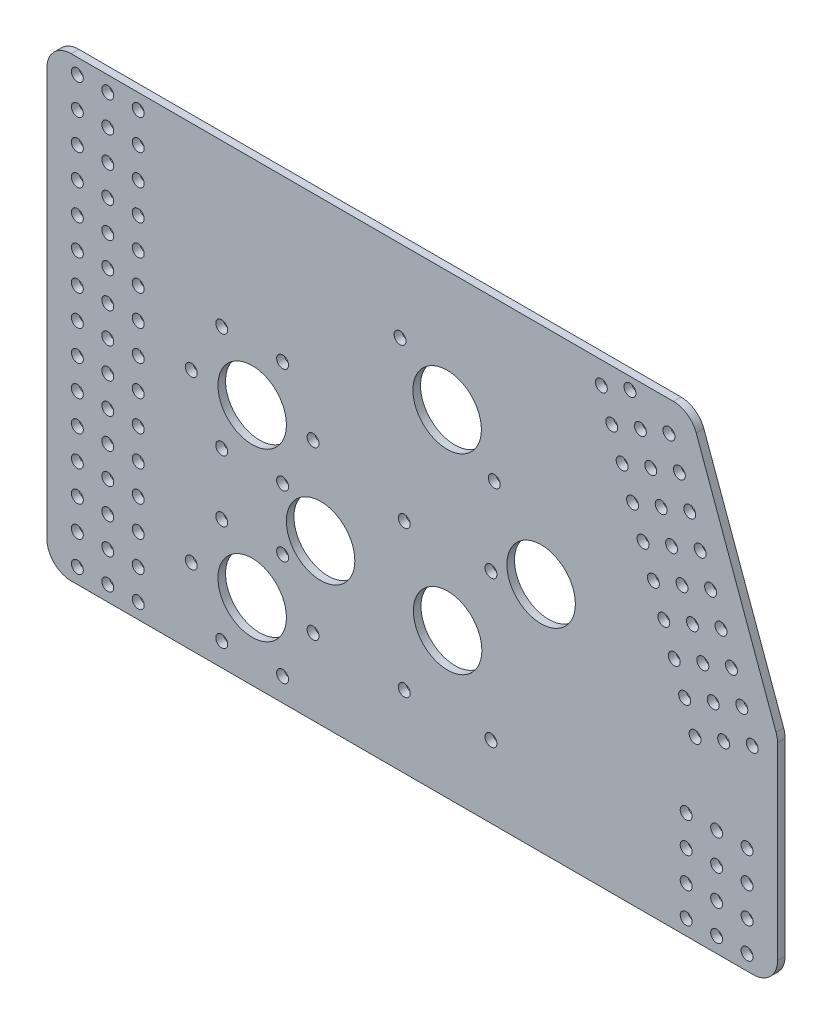
from build123d import *

# Parameters (mm, degrees)
SKETCH6_R           = 2.4892
SKETCH6_R_2         = 14.2875
BOSS_EXTRUDE1_DEPTH = 3.175
FILLET1_R           = 10.16
CUT_EXTRUDE1_START  = -3.175
SKETCH7_R           = 14.2875
SKETCH7_R_2         = 2.4892
CUT_EXTRUDE1_DEPTH  = 3.175
BOSS_EXTRUDE3_START = -3.175
SKETCH8_R           = 2.4892
BOSS_EXTRUDE3_DEPTH = 3.175
BOSS_EXTRUDE4_START = -3.175
SKETCH10_R          = 2.4892
BOSS_EXTRUDE4_DEPTH = 3.175


with BuildPart() as part:
    # Sketch6 → Boss-Extrude1 (new body)
    with BuildSketch(Plane.XY):
        Polygon((-62.034734806, 275.060295422), (206.435304788, 275.060295422), (242.765265194, 175.244549557), (242.765265194, 84.560295422), (-62.034734806, 84.560295422), align=None)
        with Locations((123.22406409, 114.608841068)):
            Circle(SKETCH6_R, mode=Mode.SUBTRACT)
        with Locations(Location((87.05446409, 114.608841068, 0), (0, 0, 180))):
            Circle(SKETCH6_R, mode=Mode.SUBTRACT)
        with Locations((-49.334734806, 268.710295422)):
            Circle(SKETCH6_R, mode=Mode.SUBTRACT)
        with Locations((-49.334734806, 90.910295422)):
            Circle(SKETCH6_R, mode=Mode.SUBTRACT)
        with Locations((-36.634734806, 268.710295422)):
            Circle(SKETCH6_R, mode=Mode.SUBTRACT)
        with Locations((-23.934734806, 268.710295422)):
            Circle(SKETCH6_R, mode=Mode.SUBTRACT)
        with Locations((-36.634734806, 256.010295422)):
            Circle(SKETCH6_R, mode=Mode.SUBTRACT)
        with Locations((-23.934734806, 256.010295422)):
            Circle(SKETCH6_R, mode=Mode.SUBTRACT)
        with Locations((-36.634734806, 243.310295422)):
            Circle(SKETCH6_R, mode=Mode.SUBTRACT)
        with Locations((-23.934734806, 243.310295422)):
            Circle(SKETCH6_R, mode=Mode.SUBTRACT)
        with Locations((-36.634734806, 230.610295422)):
            Circle(SKETCH6_R, mode=Mode.SUBTRACT)
        with Locations((-23.934734806, 230.610295422)):
            Circle(SKETCH6_R, mode=Mode.SUBTRACT)
        with Locations((-36.634734806, 217.910295422)):
            Circle(SKETCH6_R, mode=Mode.SUBTRACT)
        with Locations((-23.934734806, 217.910295422)):
            Circle(SKETCH6_R, mode=Mode.SUBTRACT)
        with Locations((-36.634734806, 205.210295422)):
            Circle(SKETCH6_R, mode=Mode.SUBTRACT)
        with Locations((-23.934734806, 205.210295422)):
            Circle(SKETCH6_R, mode=Mode.SUBTRACT)
        with Locations((-36.634734806, 192.510295422)):
            Circle(SKETCH6_R, mode=Mode.SUBTRACT)
        with Locations((-23.934734806, 192.510295422)):
            Circle(SKETCH6_R, mode=Mode.SUBTRACT)
        with Locations((-36.634734806, 179.810295422)):
            Circle(SKETCH6_R, mode=Mode.SUBTRACT)
        with Locations((-23.934734806, 179.810295422)):
            Circle(SKETCH6_R, mode=Mode.SUBTRACT)
        with Locations((-36.634734806, 167.110295422)):
            Circle(SKETCH6_R, mode=Mode.SUBTRACT)
        with Locations((-23.934734806, 167.110295422)):
            Circle(SKETCH6_R, mode=Mode.SUBTRACT)
        with Locations((-36.634734806, 154.410295422)):
            Circle(SKETCH6_R, mode=Mode.SUBTRACT)
        with Locations((-23.934734806, 154.410295422)):
            Circle(SKETCH6_R, mode=Mode.SUBTRACT)
        with Locations((-36.634734806, 141.710295422)):
            Circle(SKETCH6_R, mode=Mode.SUBTRACT)
        with Locations((-23.934734806, 141.710295422)):
            Circle(SKETCH6_R, mode=Mode.SUBTRACT)
        with Locations((-36.634734806, 129.010295422)):
            Circle(SKETCH6_R, mode=Mode.SUBTRACT)
        with Locations((-23.934734806, 129.010295422)):
            Circle(SKETCH6_R, mode=Mode.SUBTRACT)
        with Locations((-36.634734806, 116.310295422)):
            Circle(SKETCH6_R, mode=Mode.SUBTRACT)
        with Locations((-23.934734806, 116.310295422)):
            Circle(SKETCH6_R, mode=Mode.SUBTRACT)
        with Locations((-36.634734806, 103.610295422)):
            Circle(SKETCH6_R, mode=Mode.SUBTRACT)
        with Locations((-23.934734806, 103.610295422)):
            Circle(SKETCH6_R, mode=Mode.SUBTRACT)
        with Locations((-36.634734806, 90.910295422)):
            Circle(SKETCH6_R, mode=Mode.SUBTRACT)
        with Locations((-23.934734806, 90.910295422)):
            Circle(SKETCH6_R, mode=Mode.SUBTRACT)
        with Locations((-49.334734806, 256.010295422)):
            Circle(SKETCH6_R, mode=Mode.SUBTRACT)
        with Locations((-49.334734806, 243.310295422)):
            Circle(SKETCH6_R, mode=Mode.SUBTRACT)
        with Locations((-49.334734806, 230.610295422)):
            Circle(SKETCH6_R, mode=Mode.SUBTRACT)
        with Locations((-49.334734806, 217.910295422)):
            Circle(SKETCH6_R, mode=Mode.SUBTRACT)
        with Locations((-49.334734806, 205.210295422)):
            Circle(SKETCH6_R, mode=Mode.SUBTRACT)
        with Locations((-49.334734806, 192.510295422)):
            Circle(SKETCH6_R, mode=Mode.SUBTRACT)
        with Locations((-49.334734806, 179.810295422)):
            Circle(SKETCH6_R, mode=Mode.SUBTRACT)
        with Locations((-49.334734806, 167.110295422)):
            Circle(SKETCH6_R, mode=Mode.SUBTRACT)
        with Locations((-49.334734806, 154.410295422)):
            Circle(SKETCH6_R, mode=Mode.SUBTRACT)
        with Locations((-49.334734806, 141.710295422)):
            Circle(SKETCH6_R, mode=Mode.SUBTRACT)
        with Locations((-49.334734806, 129.010295422)):
            Circle(SKETCH6_R, mode=Mode.SUBTRACT)
        with Locations((-49.334734806, 116.310295422)):
            Circle(SKETCH6_R, mode=Mode.SUBTRACT)
        with Locations((-49.334734806, 103.610295422)):
            Circle(SKETCH6_R, mode=Mode.SUBTRACT)
        with Locations((169.26865969, 265.77786594)):
            Circle(SKETCH6_R, mode=Mode.SUBTRACT)
        with Locations((181.202755974, 270.121521761)):
            Circle(SKETCH6_R, mode=Mode.SUBTRACT)
        with Locations((197.480508078, 262.531081297)):
            Circle(SKETCH6_R, mode=Mode.SUBTRACT)
        with Locations((173.61231551, 253.843769656)):
            Circle(SKETCH6_R, mode=Mode.SUBTRACT)
        with Locations((185.546411794, 258.187425477)):
            Circle(SKETCH6_R, mode=Mode.SUBTRACT)
        with Locations((201.824163899, 250.596985013)):
            Circle(SKETCH6_R, mode=Mode.SUBTRACT)
        with Locations((177.955971331, 241.909673372)):
            Circle(SKETCH6_R, mode=Mode.SUBTRACT)
        with Locations((189.890067615, 246.253329193)):
            Circle(SKETCH6_R, mode=Mode.SUBTRACT)
        with Locations((206.167819719, 238.662888729)):
            Circle(SKETCH6_R, mode=Mode.SUBTRACT)
        with Locations((182.299627151, 229.975577088)):
            Circle(SKETCH6_R, mode=Mode.SUBTRACT)
        with Locations((194.233723435, 234.319232909)):
            Circle(SKETCH6_R, mode=Mode.SUBTRACT)
        with Locations((210.511475539, 226.728792445)):
            Circle(SKETCH6_R, mode=Mode.SUBTRACT)
        with Locations((186.643282971, 218.041480804)):
            Circle(SKETCH6_R, mode=Mode.SUBTRACT)
        with Locations((198.577379255, 222.385136625)):
            Circle(SKETCH6_R, mode=Mode.SUBTRACT)
        with Locations((214.855131359, 214.794696161)):
            Circle(SKETCH6_R, mode=Mode.SUBTRACT)
        with Locations((190.986938791, 206.10738452)):
            Circle(SKETCH6_R, mode=Mode.SUBTRACT)
        with Locations((202.921035075, 210.451040341)):
            Circle(SKETCH6_R, mode=Mode.SUBTRACT)
        with Locations((219.19878718, 202.860599877)):
            Circle(SKETCH6_R, mode=Mode.SUBTRACT)
        with Locations((195.330594612, 194.173288236)):
            Circle(SKETCH6_R, mode=Mode.SUBTRACT)
        with Locations((207.264690896, 198.516944057)):
            Circle(SKETCH6_R, mode=Mode.SUBTRACT)
        with Locations((223.542443, 190.926503593)):
            Circle(SKETCH6_R, mode=Mode.SUBTRACT)
        with Locations((199.674250432, 182.239191952)):
            Circle(SKETCH6_R, mode=Mode.SUBTRACT)
        with Locations((211.608346716, 186.582847773)):
            Circle(SKETCH6_R, mode=Mode.SUBTRACT)
        with Locations((227.88609882, 178.992407309)):
            Circle(SKETCH6_R, mode=Mode.SUBTRACT)
        with Locations((204.017906252, 170.305095668)):
            Circle(SKETCH6_R, mode=Mode.SUBTRACT)
        with Locations((215.952002536, 174.648751489)):
            Circle(SKETCH6_R, mode=Mode.SUBTRACT)
        with Locations((232.22975464, 167.058311025)):
            Circle(SKETCH6_R, mode=Mode.SUBTRACT)
        with Locations((208.361562072, 158.370999384)):
            Circle(SKETCH6_R, mode=Mode.SUBTRACT)
        with Locations((220.295658356, 162.714655205)):
            Circle(SKETCH6_R, mode=Mode.SUBTRACT)
        with Locations((204.665265194, 129.010295422)):
            Circle(SKETCH6_R, mode=Mode.SUBTRACT)
        with Locations((217.365265194, 129.010295422)):
            Circle(SKETCH6_R, mode=Mode.SUBTRACT)
        with Locations((230.065265194, 129.010295422)):
            Circle(SKETCH6_R, mode=Mode.SUBTRACT)
        with Locations((204.665265194, 116.310295422)):
            Circle(SKETCH6_R, mode=Mode.SUBTRACT)
        with Locations((217.365265194, 116.310295422)):
            Circle(SKETCH6_R, mode=Mode.SUBTRACT)
        with Locations((230.065265194, 116.310295422)):
            Circle(SKETCH6_R, mode=Mode.SUBTRACT)
        with Locations((204.665265194, 103.610295422)):
            Circle(SKETCH6_R, mode=Mode.SUBTRACT)
        with Locations((217.365265194, 103.610295422)):
            Circle(SKETCH6_R, mode=Mode.SUBTRACT)
        with Locations((230.065265194, 103.610295422)):
            Circle(SKETCH6_R, mode=Mode.SUBTRACT)
        with Locations((204.665265194, 90.910295422)):
            Circle(SKETCH6_R, mode=Mode.SUBTRACT)
        with Locations((217.365265194, 90.910295422)):
            Circle(SKETCH6_R, mode=Mode.SUBTRACT)
        with Locations((230.065265194, 90.910295422)):
            Circle(SKETCH6_R, mode=Mode.SUBTRACT)
        with Locations((23.601611853, 185.85256672)):
            Circle(SKETCH6_R_2, mode=Mode.SUBTRACT)
        with Locations((52.142163008, 151.05639055)):
            Circle(SKETCH6_R_2, mode=Mode.SUBTRACT)
        with Locations((23.601611853, 116.25656672)):
            Circle(SKETCH6_R_2, mode=Mode.SUBTRACT)
        with Locations((105.13926409, 145.139641068)):
            Circle(SKETCH6_R_2, mode=Mode.SUBTRACT)
        with Locations((104.944740556, 224.82726801)):
            Circle(SKETCH6_R_2, mode=Mode.SUBTRACT)
        with Locations((144.142354475, 181.392565924)):
            Circle(SKETCH6_R_2, mode=Mode.SUBTRACT)
        with Locations((85.284021432, 241.01081705)):
            Circle(SKETCH6_R, mode=Mode.SUBTRACT)
        with Locations((23.601611853, 141.65656672)):
            Circle(SKETCH6_R, mode=Mode.SUBTRACT)
        with Locations((45.598657109, 128.95656672)):
            Circle(SKETCH6_R, mode=Mode.SUBTRACT)
        with Locations((45.598657109, 103.55656672)):
            Circle(SKETCH6_R, mode=Mode.SUBTRACT)
        with Locations((23.601611853, 90.85656672)):
            Circle(SKETCH6_R, mode=Mode.SUBTRACT)
        with Locations((1.604566597, 103.55656672)):
            Circle(SKETCH6_R, mode=Mode.SUBTRACT)
        with Locations((1.604566597, 128.95656672)):
            Circle(SKETCH6_R, mode=Mode.SUBTRACT)
        with Locations((23.601611853, 211.25256672)):
            Circle(SKETCH6_R, mode=Mode.SUBTRACT)
        with Locations((45.598657109, 198.55256672)):
            Circle(SKETCH6_R, mode=Mode.SUBTRACT)
        with Locations((45.598657109, 173.15256672)):
            Circle(SKETCH6_R, mode=Mode.SUBTRACT)
        with Locations((23.601611853, 160.45256672)):
            Circle(SKETCH6_R, mode=Mode.SUBTRACT)
        with Locations((1.604566597, 173.15256672)):
            Circle(SKETCH6_R, mode=Mode.SUBTRACT)
        with Locations((1.604566597, 198.55256672)):
            Circle(SKETCH6_R, mode=Mode.SUBTRACT)
        with Locations(Location((123.22406409, 175.670441068, 0), (0, 0, 180))):
            Circle(SKETCH6_R, mode=Mode.SUBTRACT)
        with Locations((87.05446409, 175.670441068)):
            Circle(SKETCH6_R, mode=Mode.SUBTRACT)
        with Locations((124.606520638, 208.84902209)):
            Circle(SKETCH6_R, mode=Mode.SUBTRACT)
    extrude(amount=BOSS_EXTRUDE1_DEPTH)

    # Fillet1
    fillet1_edges = [part.edges().sort_by_distance(p)[0] for p in [
        (-62.034734806, 275.060295422, 1.5875),
        (206.435304788, 275.060295422, 1.5875),
        (242.765265194, 175.244549557, 1.5875),
        (242.765265194, 84.560295422, 1.5875),
        (-62.034734806, 84.560295422, 1.5875),
    ]]
    fillet(fillet1_edges, radius=FILLET1_R)

    # Sketch7 → Cut-Extrude1 (cut)
    with BuildSketch(Plane.XY.offset(3.175).offset(CUT_EXTRUDE1_START)):
        with Locations((23.601611853, 185.85256672)):
            Circle(SKETCH7_R)
        with Locations((49.001611853, 185.85256672)):
            Circle(SKETCH7_R_2)
        with Locations((36.301611853, 163.855521464)):
            Circle(SKETCH7_R_2)
        with Locations((10.901611853, 163.855521464)):
            Circle(SKETCH7_R_2)
        with Locations((-1.798388147, 185.85256672)):
            Circle(SKETCH7_R_2)
        with Locations((10.901611853, 207.849611976)):
            Circle(SKETCH7_R_2)
        with Locations((36.301611853, 207.849611976)):
            Circle(SKETCH7_R_2)
        with Locations((23.601611853, 116.25656672)):
            Circle(SKETCH7_R)
        with Locations((-1.798388147, 116.25656672)):
            Circle(SKETCH7_R_2)
        with Locations((10.901611853, 138.253611976)):
            Circle(SKETCH7_R_2)
        with Locations((36.301611853, 138.253611976)):
            Circle(SKETCH7_R_2)
        with Locations((49.001611853, 116.25656672)):
            Circle(SKETCH7_R_2)
        with Locations((36.301611853, 94.259521464)):
            Circle(SKETCH7_R_2)
        with Locations((10.901611853, 94.259521464)):
            Circle(SKETCH7_R_2)
    extrude(amount=CUT_EXTRUDE1_DEPTH, mode=Mode.SUBTRACT)

    # Sketch8 → Boss-Extrude3 (add)
    with BuildSketch(Plane.XY.offset(3.175).offset(BOSS_EXTRUDE3_START)):
        with Locations((23.601611853, 211.25256672)):
            Circle(SKETCH8_R)
        with Locations((45.598657109, 198.55256672)):
            Circle(SKETCH8_R)
        with Locations((45.598657109, 173.15256672)):
            Circle(SKETCH8_R)
        with Locations((23.601611853, 160.45256672)):
            Circle(SKETCH8_R)
        with Locations((1.604566597, 173.15256672)):
            Circle(SKETCH8_R)
        with Locations((1.604566597, 198.55256672)):
            Circle(SKETCH8_R)
    extrude(amount=BOSS_EXTRUDE3_DEPTH)

    # Sketch10 → Boss-Extrude4 (add)
    with BuildSketch(Plane.XY.offset(3.175).offset(BOSS_EXTRUDE4_START)):
        with Locations((23.601611853, 141.65656672)):
            Circle(SKETCH10_R)
        with Locations((45.598657109, 128.95656672)):
            Circle(SKETCH10_R)
        with Locations((45.598657109, 103.55656672)):
            Circle(SKETCH10_R)
        with Locations((23.601611853, 90.85656672)):
            Circle(SKETCH10_R)
        with Locations((1.604566597, 103.55656672)):
            Circle(SKETCH10_R)
        with Locations((1.604566597, 128.95656672)):
            Circle(SKETCH10_R)
    extrude(amount=BOSS_EXTRUDE4_DEPTH)


solid = part.part
